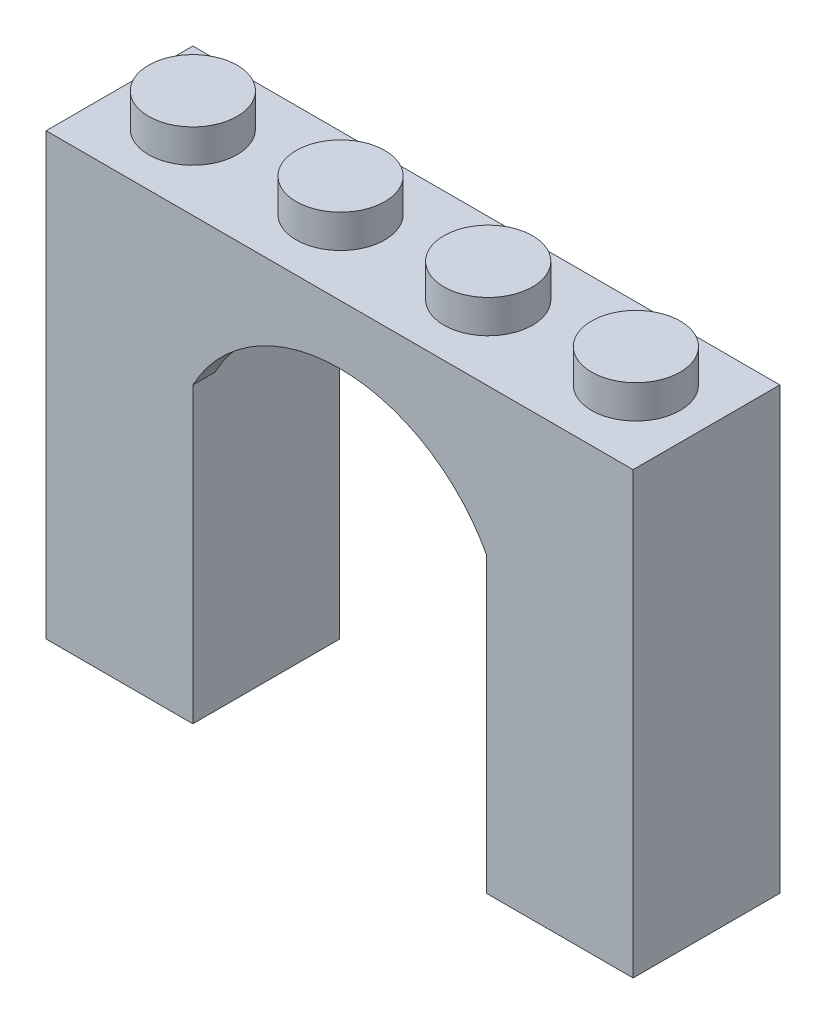
from build123d import *

# Parameters (mm, degrees)
BOSS_EXTRUDE1_DEPTH = 7.95
SKETCH2_R           = 2.4
BOSS_EXTRUDE2_DEPTH = 1.8
LPATTERN1_COUNT     = 4
LPATTERN1_PITCH     = 8
SHELL3_T            = -1.2
CUT_EXTRUDE1_START  = -1.2
SKETCH3_W           = 15.9
SKETCH3_H           = 5.55
CUT_EXTRUDE1_DEPTH  = 29.546176225


with BuildPart() as part:
    # Sketch1 → Boss-Extrude1 (new body)
    with BuildSketch(Plane.XY):
        with BuildLine():
            Line((-7.95, 0), (-15.9, 0))
            Line((-15.9, 0), (-15.9, 23.85))
            Line((-15.9, 23.85), (15.9, 23.85))
            Line((15.9, 23.85), (15.9, 0))
            Line((15.9, 0), (7.95, 0))
            Line((7.95, 0), (7.95, 15.9))
            ThreePointArc((7.95, 15.9), (0, 20.65), (-7.95, 15.9))
            Line((-7.95, 15.9), (-7.95, 0))
        make_face()
    extrude(amount=-BOSS_EXTRUDE1_DEPTH)

    # Sketch2 → Boss-Extrude2 (add)
    with BuildSketch(Plane(origin=(0, 23.85, 0), x_dir=(1, 0, 0), z_dir=(0, 1, 0))):
        with Locations(Location((-12, 4.05, 0), (0, 0, 270))):
            Circle(SKETCH2_R)
    boss_extrude2 = extrude(amount=BOSS_EXTRUDE2_DEPTH)

    # LPattern1: Boss-Extrude2 ×4
    with Locations(*[(i * LPATTERN1_PITCH, 0, 0) for i in range(1, LPATTERN1_COUNT)]):
        add(boss_extrude2)

    # Shell3
    shell3_openings = [part.faces().sort_by_distance(p)[0] for p in [
        (-11.925, 0, -3.975),
        (11.925, 0, -3.975),
    ]]
    offset(amount=SHELL3_T, openings=shell3_openings, kind=Kind.INTERSECTION)

    # Sketch3 → Cut-Extrude1 (cut, through all)
    with BuildSketch(Plane(origin=(0, 23.85, 0), x_dir=(1, 0, 0), z_dir=(0, 1, 0)).offset(CUT_EXTRUDE1_START)):
        with Locations((0, 3.975)):
            Rectangle(SKETCH3_W, SKETCH3_H)
    extrude(amount=-CUT_EXTRUDE1_DEPTH, mode=Mode.SUBTRACT)


solid = part.part
